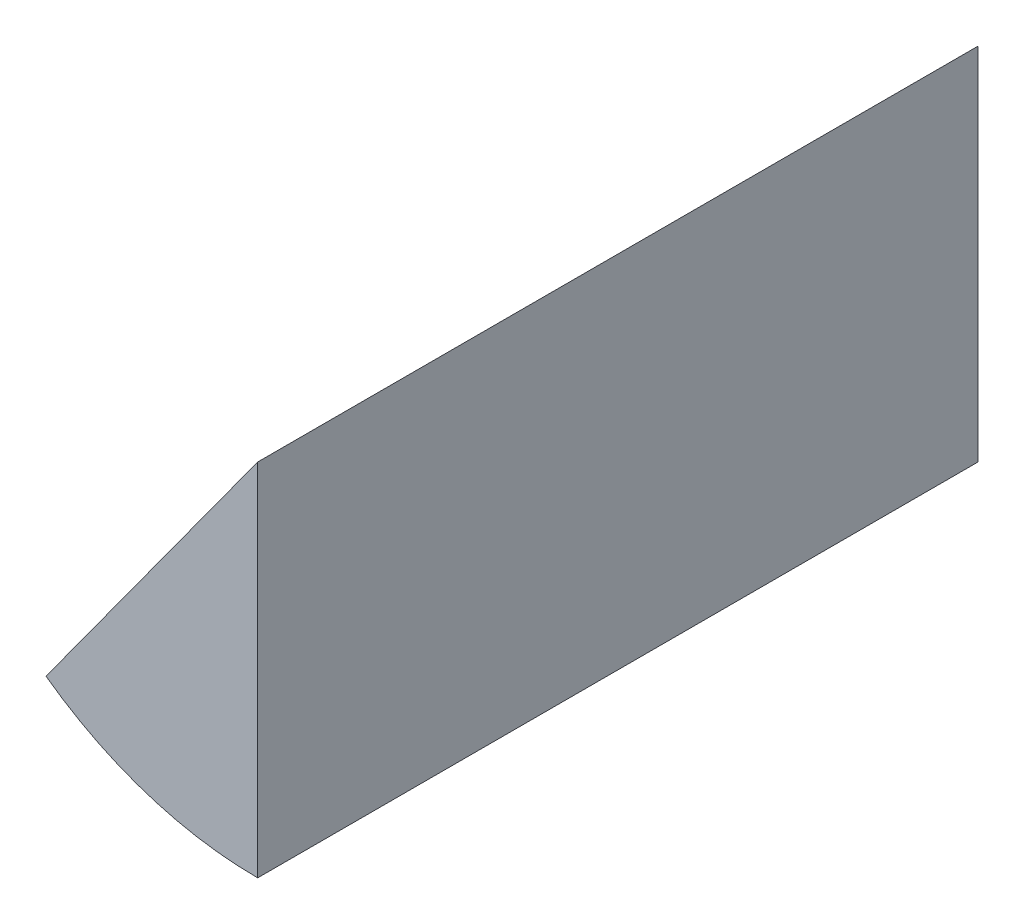
from build123d import *

# Parameters (mm, degrees)
SALIENTE_EXTRUIR1_DEPTH = 50
CROQUIS2_R              = 5.003173493
CORTAR_EXTRUIR1_DEPTH   = 10


with BuildPart() as part:
    # Croquis1 → Saliente-Extruir1 (new body)
    with BuildSketch(Plane.XY):
        with BuildLine():
            Line((0, 0), (0, -25))
            ThreePointArc((0, -25), (-7.725424859, -23.776412907), (-14.694631307, -20.225424859))
            Line((-14.694631307, -20.225424859), (0, 0))
        make_face()
    extrude(amount=SALIENTE_EXTRUIR1_DEPTH)

    # Croquis2 → Cortar-Extruir1 (cut)
    with BuildSketch(Plane(origin=(0, 0, 0), x_dir=(-1, 0, 0), z_dir=(0, 0, -1))):
        with Locations((6.053934484, -18.263154328)):
            Circle(CROQUIS2_R)
    extrude(amount=-CORTAR_EXTRUIR1_DEPTH, mode=Mode.SUBTRACT)


solid = part.part
